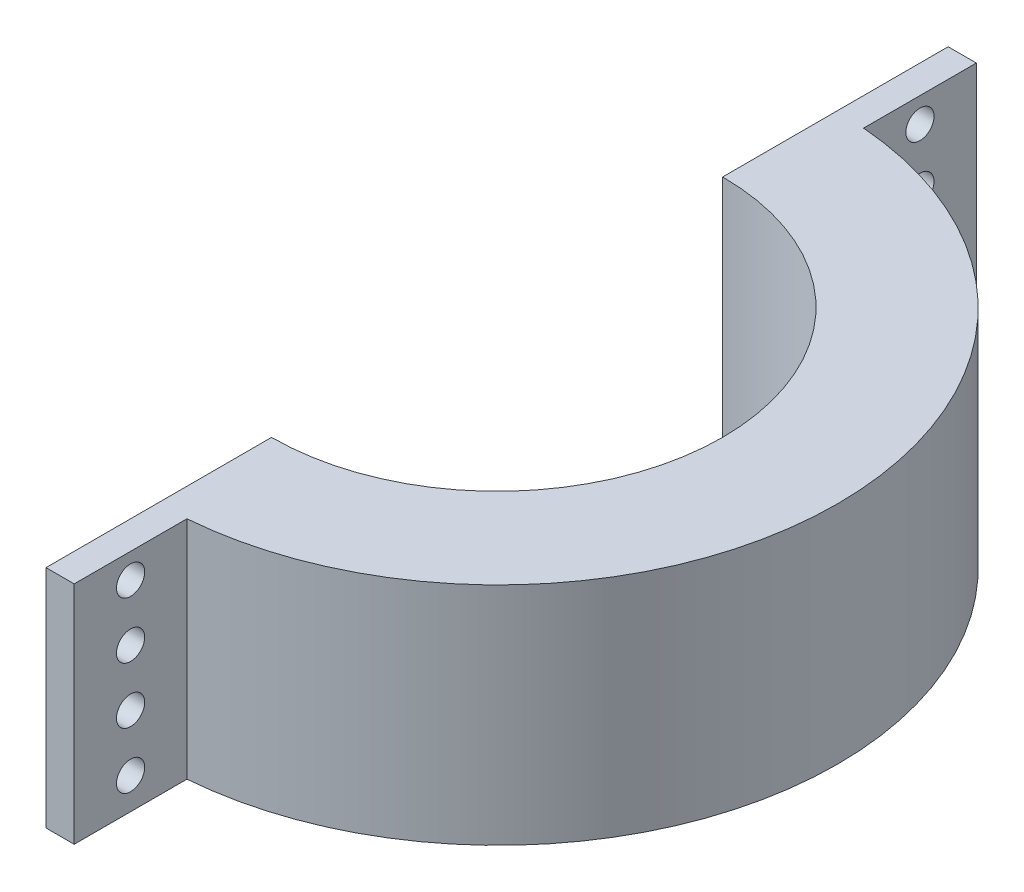
from build123d import *

# Parameters (mm, degrees)
BOSS_EXTRUDE1_DEPTH = 101.6
SKETCH2_R           = 6.35
CUT_EXTRUDE1_DEPTH  = 268.226937902
SKETCH3_R           = 6.35
CUT_EXTRUDE2_DEPTH  = 268.226937902


with BuildPart() as part:
    # Sketch1 → Boss-Extrude1 (new body)
    with BuildSketch(Plane(origin=(0, 0, 0), x_dir=(1, 0, 0), z_dir=(0, 1, 0))):
        with BuildLine():
            Line((0, -101.6), (0, -203.2))
            Line((0, -203.2), (12.7, -203.2))
            Line((12.7, -203.2), (12.7, -152.4))
            ThreePointArc((12.7, -152.4), (153.403362933, 0), (12.7, 152.4))
            Line((12.7, 152.4), (12.7, 203.2))
            Line((12.7, 203.2), (0, 203.2))
            Line((0, 203.2), (0, 101.6))
            ThreePointArc((0, 101.6), (101.6, 0), (0, -101.6))
        make_face()
    extrude(amount=BOSS_EXTRUDE1_DEPTH)

    # Sketch2 → Cut-Extrude1 (cut, through all)
    with BuildSketch(Plane(origin=(12.7, 0, 0), x_dir=(0, 0, -1), z_dir=(1, 0, 0))):
        with Locations((-177.8, 90.380321662)):
            Circle(SKETCH2_R)
        with Locations((-177.8, 64.980321662)):
            Circle(SKETCH2_R)
        with Locations((-177.8, 39.580321662)):
            Circle(SKETCH2_R)
        with Locations((-177.8, 14.180321662)):
            Circle(SKETCH2_R)
    extrude(amount=-CUT_EXTRUDE1_DEPTH, mode=Mode.SUBTRACT)

    # Sketch3 → Cut-Extrude2 (cut, through all)
    with BuildSketch(Plane(origin=(12.7, 0, 0), x_dir=(0, 0, -1), z_dir=(1, 0, 0))):
        with Locations((177.8, 90.380321662)):
            Circle(SKETCH3_R)
        with Locations((177.8, 64.980321662)):
            Circle(SKETCH3_R)
        with Locations((177.8, 39.580321662)):
            Circle(SKETCH3_R)
        with Locations((177.8, 14.180321662)):
            Circle(SKETCH3_R)
    extrude(amount=-CUT_EXTRUDE2_DEPTH, mode=Mode.SUBTRACT)


solid = part.part
